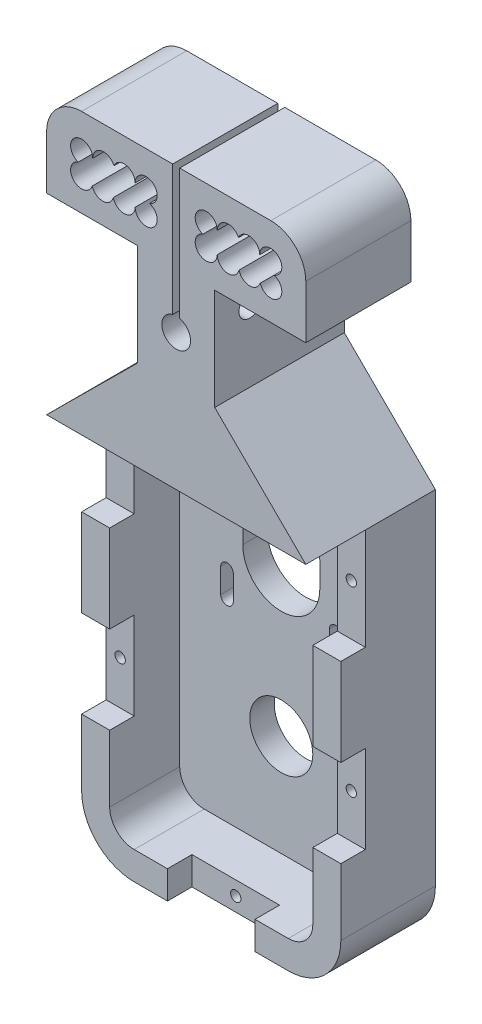
from build123d import *

# Parameters (mm, degrees)
CROQUIS2_R               = 9
SALIENTE_EXTRUIR1_DEPTH  = 7
CROQUIS2_7_W             = 25
CROQUIS2_7_H             = 8
CROQUIS2_7_W_2           = 8
CROQUIS2_7_H_2           = 25
SALIENTE_EXTRUIR3_DEPTH  = 27
CROQUIS2_12_W            = 8
CROQUIS2_12_H            = 25
CROQUIS2_12_W_2          = 25
CROQUIS2_12_H_2          = 8
SALIENTE_EXTRUIR4_DEPTH  = 20
SALIENTE_EXTRUIR5_DEPTH  = 37
CROQUIS4_R               = 1.475
CORTAR_EXTRUIR2_DEPTH    = 14
CROQUIS10_R              = 1.9
CORTAR_EXTRUIR3_DEPTH    = 22
CROQUIS11_R              = 3.1
CORTAR_EXTRUIR4_DEPTH    = 6
CORTAR_EXTRUIR5_DEPTH    = 6
SALIENTE_EXTRUIR10_DEPTH = 27
SALIENTE_EXTRUIR12_DEPTH = 3


with BuildPart() as part:
    # Croquis2 → Saliente-Extruir1 (new body)
    with BuildSketch(Plane.XY):
        with BuildLine():
            Line((-5.786620614, 40.816010109), (-30.786620614, 40.816010109))
            Line((-30.786620614, 40.816010109), (-47.286620614, 40.816010109))
            Line((-47.286620614, 40.816010109), (-47.286620614, 19.816010109))
            Line((-47.286620614, 19.816010109), (-47.286620614, -5.183989891))
            Line((-47.286620614, -5.183989891), (-47.286620614, -30.183989891))
            Line((-47.286620614, -30.183989891), (-47.286620614, -49.183989891))
            ThreePointArc((-47.286620614, -49.183989891), (-45.236368082, -54.133737359), (-40.286620614, -56.183989891))
            Line((-40.286620614, -56.183989891), (-30.786620614, -56.183989891))
            Line((-30.786620614, -56.183989891), (-5.786620614, -56.183989891))
            Line((-5.786620614, -56.183989891), (3.713379386, -56.183989891))
            ThreePointArc((3.713379386, -56.183989891), (8.663126854, -54.133737359), (10.713379386, -49.183989891))
            Line((10.713379386, -49.183989891), (10.713379386, -30.183989891))
            Line((10.713379386, -30.183989891), (10.713379386, -5.183989891))
            Line((10.713379386, -5.183989891), (10.713379386, 19.816010109))
            Line((10.713379386, 19.816010109), (10.713379386, 40.816010109))
            Line((10.713379386, 40.816010109), (-5.786620614, 40.816010109))
        make_face()
        with Locations((-18.286620614, -27.183989891)):
            Circle(CROQUIS2_R, mode=Mode.SUBTRACT)
        with BuildLine():
            ThreePointArc((-35.586620614, 6.205288522), (-33.786620614, 8.005288522), (-31.986620614, 6.205288522))
            Line((-31.986620614, 6.205288522), (-31.986620614, -0.794711478))
            ThreePointArc((-31.986620614, -0.794711478), (-33.786620614, -2.594711478), (-35.586620614, -0.794711478))
            Line((-35.586620614, -0.794711478), (-35.586620614, 6.205288522))
        make_face(mode=Mode.SUBTRACT)
        with BuildLine():
            ThreePointArc((-29.286620614, 21.705288522), (-18.286620614, 32.705288522), (-7.286620614, 21.705288522))
            Line((-7.286620614, 21.705288522), (-7.286620614, 14.705288522))
            ThreePointArc((-7.286620614, 14.705288522), (-18.286620614, 3.705288522), (-29.286620614, 14.705288522))
            Line((-29.286620614, 14.705288522), (-29.286620614, 21.705288522))
        make_face(mode=Mode.SUBTRACT)
        with BuildLine():
            ThreePointArc((-4.586620614, 6.205288522), (-2.786620614, 8.005288522), (-0.986620614, 6.205288522))
            Line((-0.986620614, 6.205288522), (-0.986620614, -0.794711478))
            ThreePointArc((-0.986620614, -0.794711478), (-2.786620614, -2.594711478), (-4.586620614, -0.794711478))
            Line((-4.586620614, -0.794711478), (-4.586620614, 6.205288522))
        make_face(mode=Mode.SUBTRACT)
        with BuildLine():
            ThreePointArc((-31.986620614, 30.205288522), (-33.786620614, 28.405288522), (-35.586620614, 30.205288522))
            Line((-35.586620614, 30.205288522), (-35.586620614, 37.205288522))
            ThreePointArc((-35.586620614, 37.205288522), (-33.786620614, 39.005288522), (-31.986620614, 37.205288522))
            Line((-31.986620614, 37.205288522), (-31.986620614, 30.205288522))
        make_face(mode=Mode.SUBTRACT)
        with BuildLine():
            ThreePointArc((-0.986620614, 30.205288522), (-2.786620614, 28.405288522), (-4.586620614, 30.205288522))
            Line((-4.586620614, 30.205288522), (-4.586620614, 37.205288522))
            ThreePointArc((-4.586620614, 37.205288522), (-2.786620614, 39.005288522), (-0.986620614, 37.205288522))
            Line((-0.986620614, 37.205288522), (-0.986620614, 30.205288522))
        make_face(mode=Mode.SUBTRACT)
    extrude(amount=SALIENTE_EXTRUIR1_DEPTH)

    # Croquis2<7> → Saliente-Extruir3 (add)
    with BuildSketch(Plane.XY):
        with Locations((-18.286620614, 44.816010109)):
            Rectangle(CROQUIS2_7_W, CROQUIS2_7_H)
        with Locations((-51.286620614, 7.316010109)):
            Rectangle(CROQUIS2_7_W_2, CROQUIS2_7_H_2)
        with Locations((14.713379386, 7.316010109)):
            Rectangle(CROQUIS2_7_W_2, CROQUIS2_7_H_2)
        with BuildLine():
            Line((-47.286620614, -30.183989891), (-55.286620614, -30.183989891))
            Line((-55.286620614, -30.183989891), (-55.286620614, -49.183989891))
            ThreePointArc((-55.286620614, -49.183989891), (-50.893222332, -59.790591609), (-40.286620614, -64.183989891))
            Line((-40.286620614, -64.183989891), (-30.786620614, -64.183989891))
            Line((-30.786620614, -64.183989891), (-30.786620614, -56.183989891))
            Line((-30.786620614, -56.183989891), (-40.286620614, -56.183989891))
            ThreePointArc((-40.286620614, -56.183989891), (-45.236368082, -54.133737359), (-47.286620614, -49.183989891))
            Line((-47.286620614, -49.183989891), (-47.286620614, -30.183989891))
        make_face()
        with BuildLine():
            Line((18.713379386, -49.183989891), (18.713379386, -30.183989891))
            Line((18.713379386, -30.183989891), (10.713379386, -30.183989891))
            Line((10.713379386, -30.183989891), (10.713379386, -49.183989891))
            ThreePointArc((10.713379386, -49.183989891), (8.663126854, -54.133737359), (3.713379386, -56.183989891))
            Line((3.713379386, -56.183989891), (-5.786620614, -56.183989891))
            Line((-5.786620614, -56.183989891), (-5.786620614, -64.183989891))
            Line((-5.786620614, -64.183989891), (3.713379386, -64.183989891))
            ThreePointArc((3.713379386, -64.183989891), (14.319981104, -59.790591609), (18.713379386, -49.183989891))
        make_face()
    extrude(amount=SALIENTE_EXTRUIR3_DEPTH)

    # Croquis2<12> → Saliente-Extruir4 (add)
    with BuildSketch(Plane.XY):
        Polygon((-30.786620614, 40.816010109), (-30.786620614, 48.816010109), (-55.286620614, 48.816010109), (-55.286620614, 19.816010109), (-47.286620614, 19.816010109), (-47.286620614, 40.816010109), align=None)
        Polygon((18.713379386, 48.816010109), (-5.786620614, 48.816010109), (-5.786620614, 40.816010109), (10.713379386, 40.816010109), (10.713379386, 19.816010109), (18.713379386, 19.816010109), align=None)
        with Locations((-51.286620614, -17.683989891)):
            Rectangle(CROQUIS2_12_W, CROQUIS2_12_H)
        with Locations((14.713379386, -17.683989891)):
            Rectangle(CROQUIS2_12_W, CROQUIS2_12_H)
        with Locations((-18.286620614, -60.183989891)):
            Rectangle(CROQUIS2_12_W_2, CROQUIS2_12_H_2)
    extrude(amount=SALIENTE_EXTRUIR4_DEPTH)

    # Croquis2<14> → Saliente-Extruir5 (add)
    with BuildSketch(Plane.XY):
        with BuildLine():
            Line((-55.286620614, 48.816010109), (-30.786620614, 48.816010109))
            Line((-30.786620614, 48.816010109), (-5.786620614, 48.816010109))
            Line((-5.786620614, 48.816010109), (18.713379386, 48.816010109))
            Line((18.713379386, 48.816010109), (-7.286620614, 74.616010109))
            Line((-7.286620614, 74.616010109), (-7.286620614, 103.616010109))
            Line((-7.286620614, 103.616010109), (-17.286620614, 103.616010109))
            Line((-17.286620614, 103.616010109), (-17.286620614, 91.616010109))
            ThreePointArc((-17.286620614, 91.616010109), (-18.286620614, 83.539831039), (-19.286620614, 91.616010109))
            Line((-19.286620614, 91.616010109), (-19.286620614, 103.616010109))
            Line((-19.286620614, 103.616010109), (-29.286620614, 103.616010109))
            Line((-29.286620614, 103.616010109), (-29.286620614, 74.616010109))
            Line((-29.286620614, 74.616010109), (-55.286620614, 48.816010109))
        make_face()
    extrude(amount=SALIENTE_EXTRUIR5_DEPTH)

    # Croquis4 → Cortar-Extruir2 (cut)
    with BuildSketch(Plane.XY.offset(27)):
        with Locations((-51.286620614, 34.316010109)):
            Circle(CROQUIS4_R)
        with Locations((-51.286620614, -17.683989891)):
            Circle(CROQUIS4_R)
        with Locations((-18.286620614, -60.183989891)):
            Circle(CROQUIS4_R)
        with Locations((14.713379386, -17.683989891)):
            Circle(CROQUIS4_R)
        with Locations((14.713379386, 34.316010109)):
            Circle(CROQUIS4_R)
    extrude(amount=-CORTAR_EXTRUIR2_DEPTH, mode=Mode.SUBTRACT)

    # Croquis10 → Cortar-Extruir3 (cut)
    with BuildSketch(Plane(origin=(-7.286620614, 0, 0), x_dir=(0, 0, -1), z_dir=(1, 0, 0))):
        with Locations((-9, 94.816010109)):
            Circle(CROQUIS10_R)
        with Locations((-18, 94.816010109)):
            Circle(CROQUIS10_R)
        with Locations((-27, 94.816010109)):
            Circle(CROQUIS10_R)
    extrude(amount=-CORTAR_EXTRUIR3_DEPTH, mode=Mode.SUBTRACT)

    # Croquis11 → Cortar-Extruir4 (cut)
    with BuildSketch(Plane(origin=(-7.286620614, 0, 0), x_dir=(0, 0, -1), z_dir=(1, 0, 0))):
        with Locations((-27, 94.816010109)):
            Circle(CROQUIS11_R)
        with Locations((-18, 94.816010109)):
            Circle(CROQUIS11_R)
        with Locations((-9, 94.816010109)):
            Circle(CROQUIS11_R)
    extrude(amount=-CORTAR_EXTRUIR4_DEPTH, mode=Mode.SUBTRACT)

    # Croquis12 → Cortar-Extruir5 (cut)
    with BuildSketch(Plane.ZY.offset(29.286620614)):
        Polygon((21.233161507, 94.816010109), (19.616580754, 97.616010109), (16.383419246, 97.616010109), (14.766838493, 94.816010109), (16.383419246, 92.016010109), (19.616580754, 92.016010109), align=None)
        Polygon((12.233161507, 94.816010109), (10.616580754, 97.616010109), (7.383419246, 97.616010109), (5.766838493, 94.816010109), (7.383419246, 92.016010109), (10.616580754, 92.016010109), align=None)
        Polygon((30.233161507, 94.816010109), (28.616580754, 97.616010109), (25.383419246, 97.616010109), (23.766838493, 94.816010109), (25.383419246, 92.016010109), (28.616580754, 92.016010109), align=None)
    extrude(amount=-CORTAR_EXTRUIR5_DEPTH, mode=Mode.SUBTRACT)

    # Croquis13 → Saliente-Extruir10 (add)
    # profile 1 of 2: a face of its own
    with BuildSketch(Plane(origin=(0, 0, 37), x_dir=(-1, 0, 0), z_dir=(0, 0, -1))):
        with BuildLine():
            Line((-18.713379386, 103.616010109), (17.286620614, 103.616010109))
            Line((17.286620614, 103.616010109), (17.286620614, 128.816010109))
            Line((17.286620614, 128.816010109), (-8.713379386, 128.816010109))
            ThreePointArc((-8.713379386, 128.816010109), (-15.784447198, 125.887077921), (-18.713379386, 118.816010109))
            Line((-18.713379386, 118.816010109), (-18.713379386, 103.616010109))
        make_face()
        with BuildLine():
            ThreePointArc((-9.673848022, 115.816010109), (-10.570396322, 121.360413399), (-5.563379386, 118.816010109))
            ThreePointArc((-5.563379386, 118.816010109), (-3.012727628, 121.908465717), (0.508545493, 119.992808733))
            ThreePointArc((0.508545493, 119.992808733), (4.035149879, 121.858844743), (6.56197986, 118.771101371))
            ThreePointArc((6.56197986, 118.771101371), (11.568996795, 121.315504661), (10.672448495, 115.771101371))
            ThreePointArc((10.672448495, 115.771101371), (11.568996795, 110.226698081), (6.56197986, 112.771101371))
            ThreePointArc((6.56197986, 112.771101371), (3.77118554, 109.641649138), (0.343902857, 112.05737628))
            ThreePointArc((0.343902857, 112.05737628), (-2.608476402, 109.667757361), (-5.713379386, 111.855541474))
            ThreePointArc((-5.713379386, 111.855541474), (-10.940765747, 110.588623748), (-9.673848022, 115.816010109))
        make_face(mode=Mode.SUBTRACT)
    # profile 2 of 2: a face of its own
    with BuildSketch(Plane(origin=(0, 0, 37), x_dir=(-1, 0, 0), z_dir=(0, 0, -1))):
        with BuildLine():
            Line((19.286620614, 128.816010109), (19.286620614, 103.616010109))
            Line((19.286620614, 103.616010109), (55.286620614, 103.616010109))
            Line((55.286620614, 103.616010109), (55.286620614, 118.816010109))
            ThreePointArc((55.286620614, 118.816010109), (52.357688426, 125.887077921), (45.286620614, 128.816010109))
            Line((45.286620614, 128.816010109), (19.286620614, 128.816010109))
        make_face()
        with BuildLine():
            ThreePointArc((36.229338371, 112.05737628), (32.802055688, 109.641649138), (30.011261368, 112.771101371))
            ThreePointArc((30.011261368, 112.771101371), (25.004244432, 110.226698081), (25.900792732, 115.771101371))
            ThreePointArc((25.900792732, 115.771101371), (25.004244432, 121.315504661), (30.011261368, 118.771101371))
            ThreePointArc((30.011261368, 118.771101371), (32.538091349, 121.858844743), (36.064695735, 119.992808733))
            ThreePointArc((36.064695735, 119.992808733), (39.585968856, 121.908465717), (42.136620614, 118.816010109))
            ThreePointArc((42.136620614, 118.816010109), (47.143637549, 121.360413399), (46.24708925, 115.816010109))
            ThreePointArc((46.24708925, 115.816010109), (47.514006975, 110.588623748), (42.286620614, 111.855541474))
            ThreePointArc((42.286620614, 111.855541474), (39.181717629, 109.667757361), (36.229338371, 112.05737628))
        make_face(mode=Mode.SUBTRACT)
    extrude(amount=SALIENTE_EXTRUIR10_DEPTH)

    # Croquis15 → Saliente-Extruir12 (add)
    with BuildSketch(Plane(origin=(0, 0, 10), x_dir=(-1, 0, 0), z_dir=(0, 0, -1))):
        with BuildLine():
            Line((17.286620614, 103.616010109), (17.286620614, 128.816010109))
            Line((17.286620614, 128.816010109), (-8.713379386, 128.816010109))
            ThreePointArc((-8.713379386, 128.816010109), (-15.784447198, 125.887077921), (-18.713379386, 118.816010109))
            Line((-18.713379386, 118.816010109), (-18.713379386, 103.616010109))
            Line((-18.713379386, 103.616010109), (17.286620614, 103.616010109))
        make_face()
        with BuildLine():
            Line((19.286620614, 103.616010109), (55.286620614, 103.616010109))
            Line((55.286620614, 103.616010109), (55.286620614, 118.816010109))
            ThreePointArc((55.286620614, 118.816010109), (52.357688426, 125.887077921), (45.286620614, 128.816010109))
            Line((45.286620614, 128.816010109), (19.286620614, 128.816010109))
            Line((19.286620614, 128.816010109), (19.286620614, 103.616010109))
        make_face()
    extrude(amount=SALIENTE_EXTRUIR12_DEPTH)


solid = part.part
